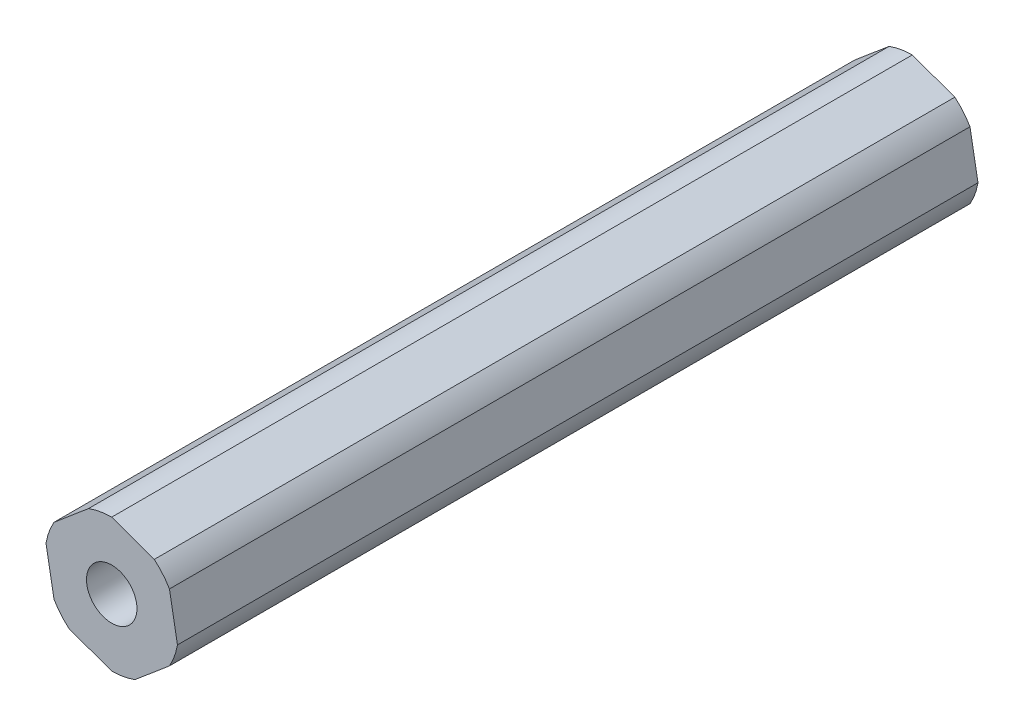
from build123d import *

# Parameters (mm, degrees)
BOSS_EXTRUDE1_DEPTH         = 81.0641
SKETCH2_R                   = 2.0193
CUT_EXTRUDE1_DEPTH          = 82.616381459
F_1_4_20_TAPPED_HOLE1_D     = 5.1054
F_1_4_20_TAPPED_HOLE1_DEPTH = 19.05
F_1_4_20_TAPPED_HOLE1_TIP   = 1.533816902
F_1_4_20_TAPPED_HOLE2_D     = 5.1054
F_1_4_20_TAPPED_HOLE2_DEPTH = 19.05
F_1_4_20_TAPPED_HOLE2_TIP   = 1.533816902


with BuildPart() as part:
    # Sketch1 → Boss-Extrude1 (new body)
    with BuildSketch(Plane.XY):
        with BuildLine():
            Line((-6.654540832, 1.131188008), (-5.845671476, -3.375))
            ThreePointArc((-5.845671476, -3.375), (-5.15742276, -4.354709), (-4.306907968, -5.197407407))
            Line((-4.306907968, -5.197407407), (0, -6.75))
            ThreePointArc((0, -6.75), (1.19257724, -6.643813628), (2.347632865, -6.328595415))
            Line((2.347632865, -6.328595415), (5.845671476, -3.375))
            ThreePointArc((5.845671476, -3.375), (6.35, -2.289104628), (6.654540832, -1.131188008))
            Line((6.654540832, -1.131188008), (5.845671476, 3.375))
            ThreePointArc((5.845671476, 3.375), (5.15742276, 4.354709), (4.306907968, 5.197407407))
            Line((4.306907968, 5.197407407), (0, 6.75))
            ThreePointArc((0, 6.75), (-1.19257724, 6.643813628), (-2.347632865, 6.328595415))
            Line((-2.347632865, 6.328595415), (-5.845671476, 3.375))
            ThreePointArc((-5.845671476, 3.375), (-6.35, 2.289104628), (-6.654540832, 1.131188008))
        make_face()
    extrude(amount=BOSS_EXTRUDE1_DEPTH)

    # Sketch2 → Cut-Extrude1 (cut, through all)
    with BuildSketch(Plane.XY.offset(81.0641)):
        Circle(SKETCH2_R)
    extrude(amount=-CUT_EXTRUDE1_DEPTH, mode=Mode.SUBTRACT)

    # 1/4-20 Tapped Hole1
    with Locations(Plane.XY.offset(81.0641)):
        with Locations((0, 0)):
            Hole(F_1_4_20_TAPPED_HOLE1_D / 2, depth=F_1_4_20_TAPPED_HOLE1_DEPTH)
            with Locations((0, 0, -(F_1_4_20_TAPPED_HOLE1_DEPTH + F_1_4_20_TAPPED_HOLE1_TIP / 2))):  # 118° drill point
                Cone(0, F_1_4_20_TAPPED_HOLE1_D / 2, F_1_4_20_TAPPED_HOLE1_TIP, mode=Mode.SUBTRACT)

    # 1/4-20 Tapped Hole2
    with Locations(Plane(origin=(0, 0, 0), x_dir=(-1, 0, 0), z_dir=(0, 0, -1))):
        with Locations((0, 0)):
            Hole(F_1_4_20_TAPPED_HOLE2_D / 2, depth=F_1_4_20_TAPPED_HOLE2_DEPTH)
            with Locations((0, 0, -(F_1_4_20_TAPPED_HOLE2_DEPTH + F_1_4_20_TAPPED_HOLE2_TIP / 2))):  # 118° drill point
                Cone(0, F_1_4_20_TAPPED_HOLE2_D / 2, F_1_4_20_TAPPED_HOLE2_TIP, mode=Mode.SUBTRACT)


solid = part.part
